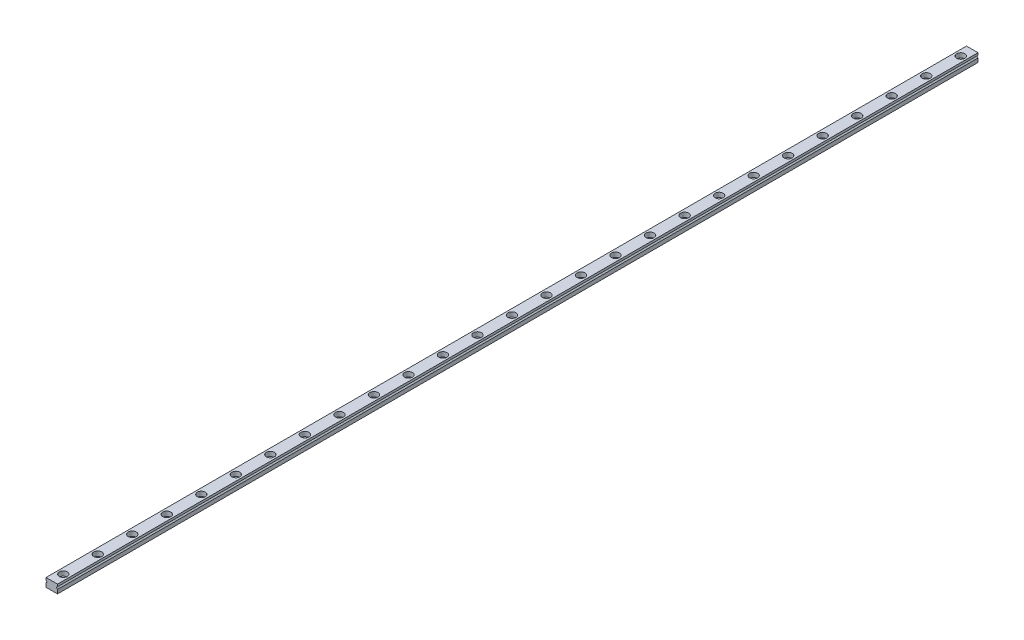
from build123d import *

# Parameters (mm, degrees)
SKETCH1_W           = 5
SKETCH1_H           = 3.7
BOSS_EXTRUDE1_DEPTH = 400
SKETCH2_R           = 1.75
CUT_EXTRUDE1_DEPTH  = 2
SKETCH3_R           = 1
CUT_EXTRUDE2_DEPTH  = 401.036248358
CUT_EXTRUDE3_DEPTH  = 401.048359577


with BuildPart() as part:
    # Sketch1 → Boss-Extrude1 (new body)
    with BuildSketch(Plane.XY):
        with Locations((2.5, 1.85)):
            Rectangle(SKETCH1_W, SKETCH1_H)
    extrude(amount=-BOSS_EXTRUDE1_DEPTH)

    # Sketch2 → Cut-Extrude1 (cut)
    with BuildSketch(Plane(origin=(0, 3.7, 0), x_dir=(1, 0, 0), z_dir=(0, 1, 0))):
        with Locations(Location((2.5, 5, 0), (0, 0, 270))):
            Circle(SKETCH2_R)
        with Locations(Location((2.5, 20, 0), (0, 0, 270))):
            Circle(SKETCH2_R)
        with Locations(Location((2.5, 35, 0), (0, 0, 270))):
            Circle(SKETCH2_R)
        with Locations(Location((2.5, 50, 0), (0, 0, 270))):
            Circle(SKETCH2_R)
        with Locations(Location((2.5, 65, 0), (0, 0, 270))):
            Circle(SKETCH2_R)
        with Locations(Location((2.5, 80, 0), (0, 0, 270))):
            Circle(SKETCH2_R)
        with Locations(Location((2.5, 95, 0), (0, 0, 270))):
            Circle(SKETCH2_R)
        with Locations(Location((2.5, 110, 0), (0, 0, 270))):
            Circle(SKETCH2_R)
        with Locations(Location((2.5, 125, 0), (0, 0, 270))):
            Circle(SKETCH2_R)
        with Locations(Location((2.5, 140, 0), (0, 0, 270))):
            Circle(SKETCH2_R)
        with Locations(Location((2.5, 155, 0), (0, 0, 270))):
            Circle(SKETCH2_R)
        with Locations(Location((2.5, 170, 0), (0, 0, 270))):
            Circle(SKETCH2_R)
        with Locations(Location((2.5, 185, 0), (0, 0, 270))):
            Circle(SKETCH2_R)
        with Locations(Location((2.5, 200, 0), (0, 0, 270))):
            Circle(SKETCH2_R)
        with Locations(Location((2.5, 215, 0), (0, 0, 270))):
            Circle(SKETCH2_R)
        with Locations(Location((2.5, 230, 0), (0, 0, 270))):
            Circle(SKETCH2_R)
        with Locations(Location((2.5, 245, 0), (0, 0, 270))):
            Circle(SKETCH2_R)
        with Locations(Location((2.5, 260, 0), (0, 0, 270))):
            Circle(SKETCH2_R)
        with Locations(Location((2.5, 275, 0), (0, 0, 270))):
            Circle(SKETCH2_R)
        with Locations(Location((2.5, 290, 0), (0, 0, 270))):
            Circle(SKETCH2_R)
        with Locations(Location((2.5, 305, 0), (0, 0, 270))):
            Circle(SKETCH2_R)
        with Locations(Location((2.5, 320, 0), (0, 0, 270))):
            Circle(SKETCH2_R)
        with Locations(Location((2.5, 335, 0), (0, 0, 270))):
            Circle(SKETCH2_R)
        with Locations(Location((2.5, 350, 0), (0, 0, 270))):
            Circle(SKETCH2_R)
        with Locations(Location((2.5, 365, 0), (0, 0, 270))):
            Circle(SKETCH2_R)
        with Locations(Location((2.5, 380, 0), (0, 0, 270))):
            Circle(SKETCH2_R)
        with Locations(Location((2.5, 395, 0), (0, 0, 270))):
            Circle(SKETCH2_R)
    extrude(amount=-CUT_EXTRUDE1_DEPTH, mode=Mode.SUBTRACT)

    # Sketch3 → Cut-Extrude2 (cut, through all)
    with BuildSketch(Plane(origin=(0, 1.7, 0), x_dir=(1, 0, 0), z_dir=(0, 1, 0))):
        with Locations(Location((2.5, 5, 0), (0, 0, 270))):
            Circle(SKETCH3_R)
        with Locations(Location((2.5, 20, 0), (0, 0, 270))):
            Circle(SKETCH3_R)
        with Locations(Location((2.5, 35, 0), (0, 0, 270))):
            Circle(SKETCH3_R)
        with Locations(Location((2.5, 50, 0), (0, 0, 270))):
            Circle(SKETCH3_R)
        with Locations(Location((2.5, 65, 0), (0, 0, 270))):
            Circle(SKETCH3_R)
        with Locations(Location((2.5, 80, 0), (0, 0, 270))):
            Circle(SKETCH3_R)
        with Locations(Location((2.5, 95, 0), (0, 0, 270))):
            Circle(SKETCH3_R)
        with Locations(Location((2.5, 110, 0), (0, 0, 270))):
            Circle(SKETCH3_R)
        with Locations(Location((2.5, 125, 0), (0, 0, 270))):
            Circle(SKETCH3_R)
        with Locations(Location((2.5, 140, 0), (0, 0, 270))):
            Circle(SKETCH3_R)
        with Locations(Location((2.5, 155, 0), (0, 0, 270))):
            Circle(SKETCH3_R)
        with Locations(Location((2.5, 170, 0), (0, 0, 270))):
            Circle(SKETCH3_R)
        with Locations(Location((2.5, 185, 0), (0, 0, 270))):
            Circle(SKETCH3_R)
        with Locations(Location((2.5, 200, 0), (0, 0, 270))):
            Circle(SKETCH3_R)
        with Locations(Location((2.5, 215, 0), (0, 0, 270))):
            Circle(SKETCH3_R)
        with Locations(Location((2.5, 230, 0), (0, 0, 270))):
            Circle(SKETCH3_R)
        with Locations(Location((2.5, 245, 0), (0, 0, 270))):
            Circle(SKETCH3_R)
        with Locations(Location((2.5, 260, 0), (0, 0, 270))):
            Circle(SKETCH3_R)
        with Locations(Location((2.5, 275, 0), (0, 0, 270))):
            Circle(SKETCH3_R)
        with Locations(Location((2.5, 290, 0), (0, 0, 270))):
            Circle(SKETCH3_R)
        with Locations(Location((2.5, 305, 0), (0, 0, 270))):
            Circle(SKETCH3_R)
        with Locations(Location((2.5, 320, 0), (0, 0, 270))):
            Circle(SKETCH3_R)
        with Locations(Location((2.5, 335, 0), (0, 0, 270))):
            Circle(SKETCH3_R)
        with Locations(Location((2.5, 350, 0), (0, 0, 270))):
            Circle(SKETCH3_R)
        with Locations(Location((2.5, 365, 0), (0, 0, 270))):
            Circle(SKETCH3_R)
        with Locations(Location((2.5, 380, 0), (0, 0, 270))):
            Circle(SKETCH3_R)
        with Locations(Location((2.5, 395, 0), (0, 0, 270))):
            Circle(SKETCH3_R)
    extrude(amount=-CUT_EXTRUDE2_DEPTH, mode=Mode.SUBTRACT)

    # Sketch4 → Cut-Extrude3 (cut, through all)
    with BuildSketch(Plane.XY):
        Polygon((0, 2.7), (0.5, 2.2), (0, 1.7), align=None)
        Polygon((5, 2.7), (4.5, 2.2), (5, 1.7), align=None)
    extrude(amount=-CUT_EXTRUDE3_DEPTH, mode=Mode.SUBTRACT)


solid = part.part
